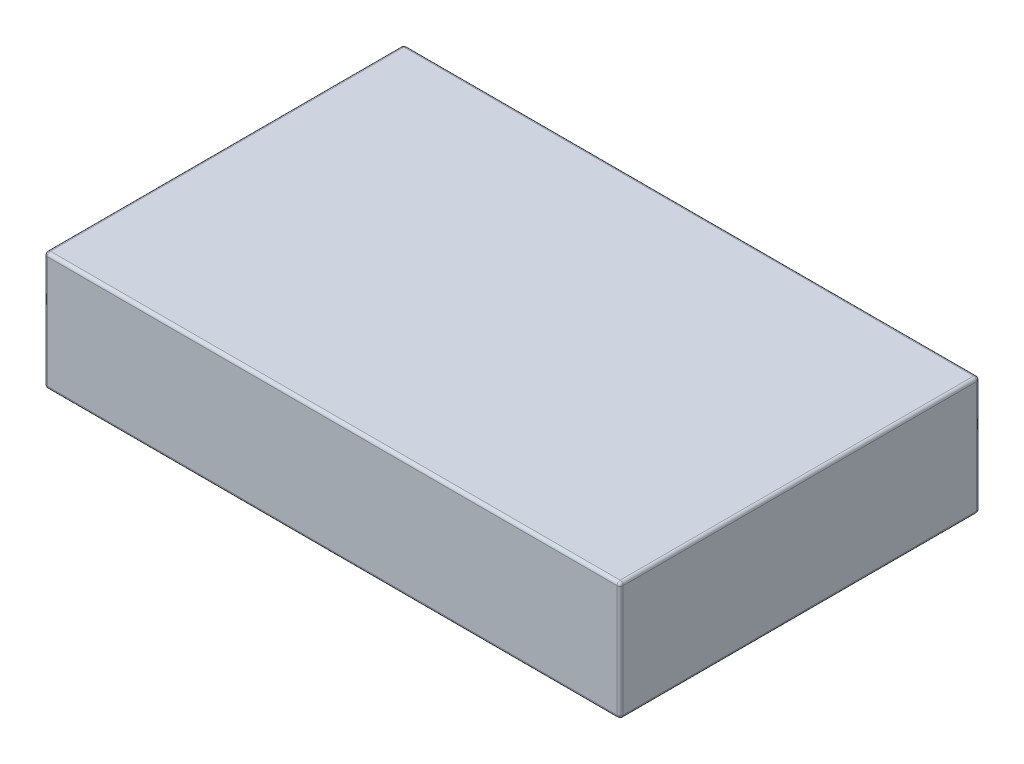
from build123d import *

# Parameters (mm, degrees)
SKETCH_1_W      = 365
SKETCH_1_H      = 228
EXTRUDE_1_DEPTH = 75
SKETCH_2_R      = 7.5
EXTRUDE_2_DEPTH = 15
FILLET_1_R      = 2


with BuildPart() as part:
    # 草图1 → 凸台-拉伸1 (new body)
    with BuildSketch(Plane(origin=(0, 0, 0), x_dir=(1, 0, 0), z_dir=(0, 1, 0))):
        Rectangle(SKETCH_1_W, SKETCH_1_H)
    extrude(amount=EXTRUDE_1_DEPTH)

    # 草图2 → 凸台-拉伸2 (add)
    with BuildSketch(Plane.ZY.offset(182.5)):
        with Locations(Location((-86, 37.5, 0), (0, 0, 180))):
            Circle(SKETCH_2_R)
        with Locations(Location((86, 37.5, 0), (0, 0, 180))):
            Circle(SKETCH_2_R)
    extrude(amount=EXTRUDE_2_DEPTH)

    # 圆角1
    fillet_1_edges = [part.edges().sort_by_distance(p)[0] for p in [
        (182.5, 75, 0),
        (0, 75, -114),
        (-182.5, 75, 0),
        (0, 0, -114),
        (182.5, 0, 0),
        (0, 0, 114),
        (-182.5, 0, 0),
        (-182.5, 37.5, -114),
        (182.5, 37.5, -114),
        (182.5, 37.5, 114),
        (-182.5, 37.5, 114),
        (0, 75, 114),
    ]]
    fillet(fillet_1_edges, radius=FILLET_1_R)


solid = part.part
